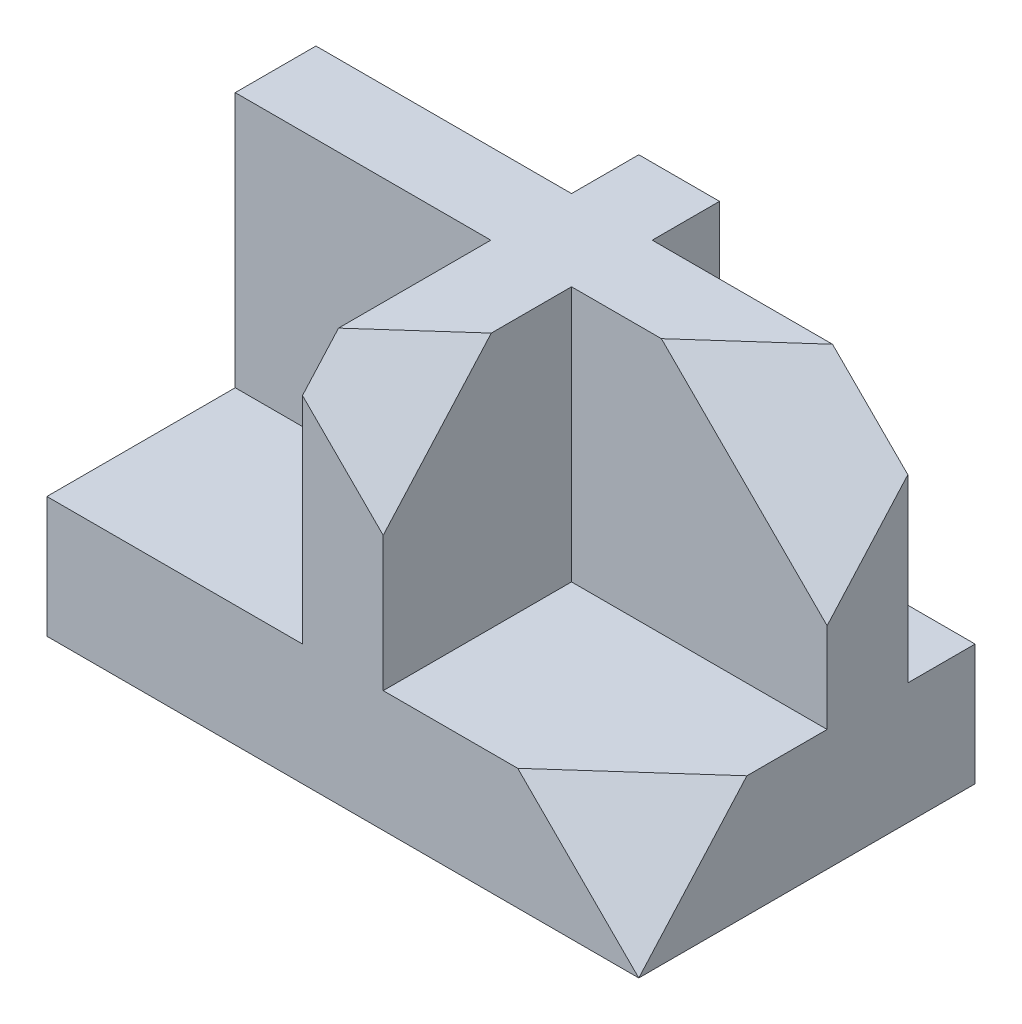
from build123d import *

# Parameters (mm, degrees)
SKETCH1_W           = 88
SKETCH1_H           = 50
BOSS_EXTRUDE1_DEPTH = 18
BOSS_EXTRUDE2_DEPTH = 38
SKETCH5_W           = 84.396009533
SKETCH5_H           = 88.284565511
CUT_EXTRUDE1_DEPTH  = 38


with BuildPart() as part:
    # Sketch1 → Boss-Extrude1 (new body)
    with BuildSketch(Plane(origin=(0, 0, 0), x_dir=(1, 0, 0), z_dir=(0, 1, 0))):
        with Locations((44, 25)):
            Rectangle(SKETCH1_W, SKETCH1_H)
    extrude(amount=BOSS_EXTRUDE1_DEPTH)

    # Sketch2 → Boss-Extrude2 (add)
    with BuildSketch(Plane(origin=(0, 18, 0), x_dir=(1, 0, 0), z_dir=(0, 1, 0))):
        Polygon((38, 50), (50, 50), (50, 40), (88, 40), (88, 28), (50, 28), (50, 0), (38, 0), (38, 28), (0, 28), (0, 40), (38, 40), align=None)
    extrude(amount=BOSS_EXTRUDE2_DEPTH)

    # Sketch5 → Cut-Extrude1 (cut)
    with BuildSketch(Plane(origin=(27.040314651, 27.040314651, 30.285152409), x_dir=(-0.832300244592347, 0.3691892497304552, 0.41349195969810976), z_dir=(-0.5543250876981121, -0.5543250876981181, -0.620844098221892))):
        with Locations((-46.281011604, 31.412596513)):
            Rectangle(SKETCH5_W, SKETCH5_H)
    extrude(amount=-CUT_EXTRUDE1_DEPTH, mode=Mode.SUBTRACT)


solid = part.part
